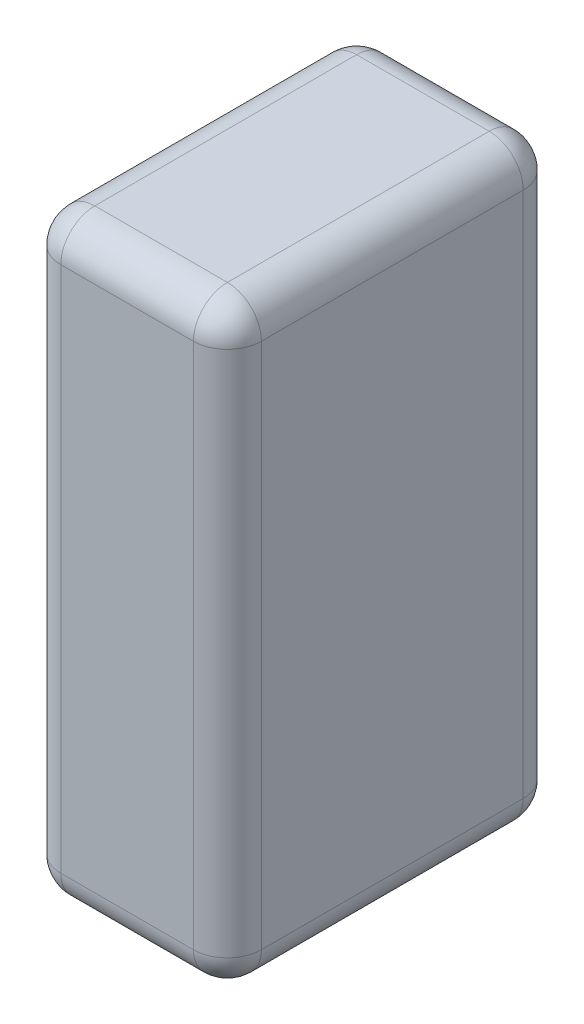
from build123d import *

# Parameters (mm, degrees)
SKETCH1_W           = 5.9
SKETCH1_H           = 9.7
BOSS_EXTRUDE1_DEPTH = 17.5
FILLET1_R           = 1


with BuildPart() as part:
    # Sketch1 → Boss-Extrude1 (new body)
    with BuildSketch(Plane(origin=(0, 0, 0), x_dir=(1, 0, 0), z_dir=(0, 1, 0))):
        Rectangle(SKETCH1_W, SKETCH1_H)
    extrude(amount=BOSS_EXTRUDE1_DEPTH)

    # Fillet1
    fillet1_edges = [part.edges().sort_by_distance(p)[0] for p in [
        (-2.95, 17.5, 0),
        (0, 17.5, 4.85),
        (2.95, 17.5, 0),
        (0, 0, 4.85),
        (-2.95, 0, 0),
        (0, 0, -4.85),
        (2.95, 0, 0),
        (2.95, 8.75, 4.85),
        (-2.95, 8.75, 4.85),
        (-2.95, 8.75, -4.85),
        (2.95, 8.75, -4.85),
        (0, 17.5, -4.85),
    ]]
    fillet(fillet1_edges, radius=FILLET1_R)


solid = part.part
